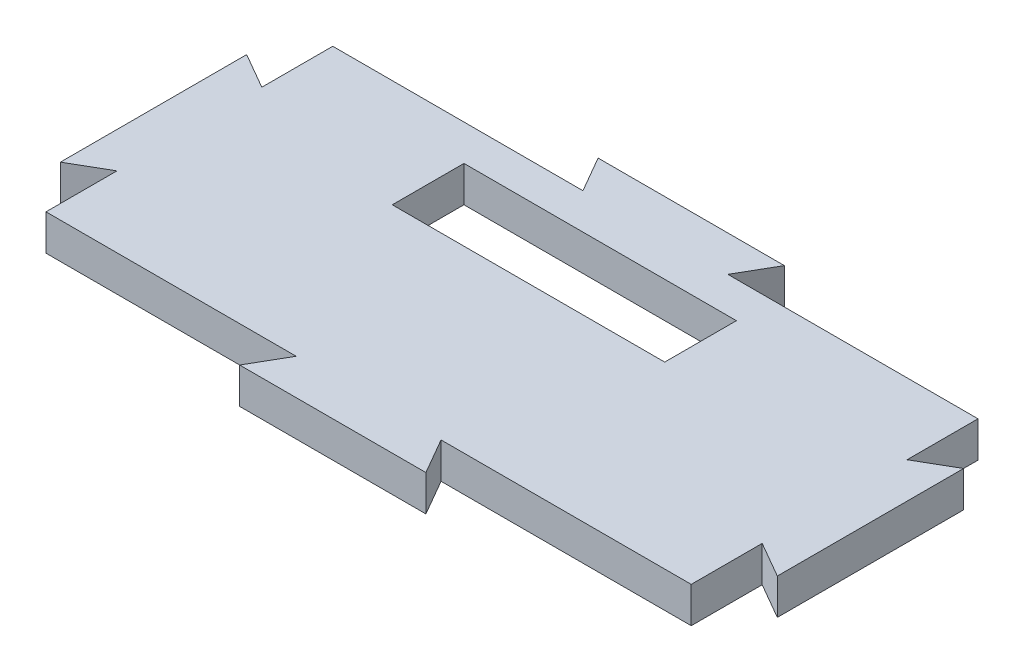
from build123d import *

# Parameters (mm, degrees)
SKETCH2_W           = 90
SKETCH2_H           = 40
BOSS_EXTRUDE1_DEPTH = 5
CUT_EXTRUDE1_DEPTH  = 10


with BuildPart() as part:
    # Sketch2 → Boss-Extrude1 (new body)
    with BuildSketch(Plane(origin=(0, 0, 0), x_dir=(-1, 0, 0), z_dir=(0, 1, 0))):
        Polygon((-50, -12.990381057), (-50, 12.990381057), (-27.5, 0), align=None)
        Rectangle(SKETCH2_W, SKETCH2_H)
        Polygon((50, 12.990381057), (27.5, 0), (50, -12.990381057), align=None)
        Polygon((12.990381057, 25), (-12.990381057, 25), (0, 2.5), align=None)
        Polygon((0, -2.5), (12.990381057, -25), (-12.990381057, -25), align=None)
    extrude(amount=BOSS_EXTRUDE1_DEPTH)

    # Sketch3 → Cut-Extrude1 (cut)
    with BuildSketch(Plane(origin=(0, 5, 0), x_dir=(-1, 0, 0), z_dir=(0, 1, 0))):
        Polygon((-16.3, -7.529573217), (-16.3, -15), (21.7, -15), (21.7, -5), (-16.3, -5), align=None)
    extrude(amount=-CUT_EXTRUDE1_DEPTH, mode=Mode.SUBTRACT)


solid = part.part
